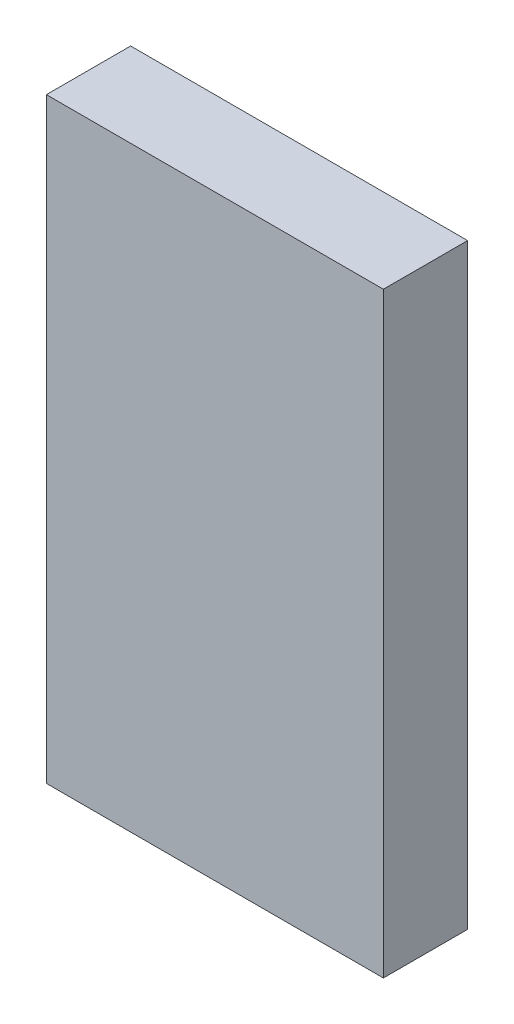
from build123d import *

# Parameters (mm, degrees)
SKETCH1_W           = 12.7
SKETCH1_H           = 3.175
BOSS_EXTRUDE1_DEPTH = 22.479


with BuildPart() as part:
    # Sketch1 → Boss-Extrude1 (new body)
    with BuildSketch(Plane(origin=(0, 0, 0), x_dir=(1, 0, 0), z_dir=(0, 1, 0))):
        with Locations((6.35, 1.5875)):
            Rectangle(SKETCH1_W, SKETCH1_H)
    extrude(amount=BOSS_EXTRUDE1_DEPTH)


solid = part.part
